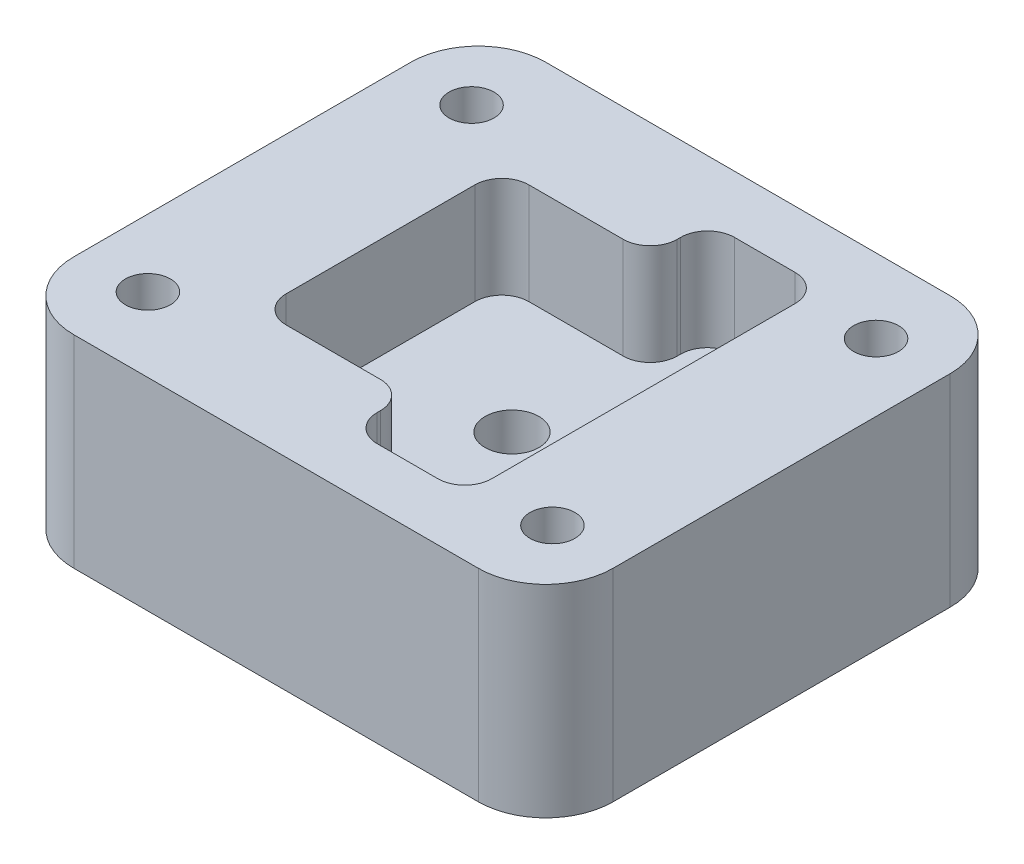
from build123d import *

# Parameters (mm, degrees)
SKETCH1_W           = 40
SKETCH1_H           = 35
SKETCH1_R           = 1.666666667
BOSS_EXTRUDE1_DEPTH = 15
FILLET1_R           = 5
CUT_EXTRUDE1_DEPTH  = 7.5
FILLET2_R           = 2
SKETCH5_R           = 2
CUT_EXTRUDE2_DEPTH  = 7.5
SKETCH6_R           = 5
CUT_EXTRUDE3_DEPTH  = 2.5


with BuildPart() as part:
    # Sketch1 → Boss-Extrude1 (new body)
    with BuildSketch(Plane(origin=(0, 0, 0), x_dir=(1, 0, 0), z_dir=(0, 1, 0))):
        with Locations((20, 17.5)):
            Rectangle(SKETCH1_W, SKETCH1_H)
        with Locations(Location((5, 29.5, 0), (0, 0, 270))):
            Circle(SKETCH1_R, mode=Mode.SUBTRACT)
        with Locations(Location((35, 29.5, 0), (0, 0, 270))):
            Circle(SKETCH1_R, mode=Mode.SUBTRACT)
        with Locations(Location((5, 5.5, 0), (0, 0, 270))):
            Circle(SKETCH1_R, mode=Mode.SUBTRACT)
        with Locations(Location((35, 5.5, 0), (0, 0, 270))):
            Circle(SKETCH1_R, mode=Mode.SUBTRACT)
    extrude(amount=BOSS_EXTRUDE1_DEPTH)

    # Fillet1
    fillet1_edges = [part.edges().sort_by_distance(p)[0] for p in [
        (0, 7.5, -35),
        (40, 7.5, -35),
        (40, 7.5, 0),
        (0, 7.5, 0),
    ]]
    fillet(fillet1_edges, radius=FILLET1_R)

    # Sketch4 → Cut-Extrude1 (cut)
    with BuildSketch(Plane(origin=(0, 15, 0), x_dir=(1, 0, 0), z_dir=(0, 1, 0))):
        Polygon((29.75, 30.75), (21.25, 30.75), (21.25, 26.5), (10.25, 26.5), (10.25, 8.5), (21.25, 8.5), (21.25, 4.25), (29.75, 4.25), align=None)
    extrude(amount=-CUT_EXTRUDE1_DEPTH, mode=Mode.SUBTRACT)

    # Fillet2
    fillet2_edges = [part.edges().sort_by_distance(p)[0] for p in [
        (21.25, 11.25, -26.5),
        (21.25, 11.25, -30.75),
        (29.75, 11.25, -30.75),
        (29.75, 11.25, -4.25),
        (21.25, 11.25, -4.25),
        (21.25, 11.25, -8.5),
        (10.25, 11.25, -8.5),
        (10.25, 11.25, -26.5),
    ]]
    fillet(fillet2_edges, radius=FILLET2_R)

    # Sketch5 → Cut-Extrude2 (cut)
    with BuildSketch(Plane(origin=(0, 7.5, 0), x_dir=(1, 0, 0), z_dir=(0, 1, 0))):
        with Locations(Location((20, 17.5, 0), (0, 0, 270))):
            Circle(SKETCH5_R)
    extrude(amount=-CUT_EXTRUDE2_DEPTH, mode=Mode.SUBTRACT)

    # Sketch6 → Cut-Extrude3 (cut)
    with BuildSketch(Plane.XZ):
        with Locations(Location((20, -17.5, 0), (0, 0, 270))):
            Circle(SKETCH6_R)
    extrude(amount=-CUT_EXTRUDE3_DEPTH, mode=Mode.SUBTRACT)


solid = part.part
